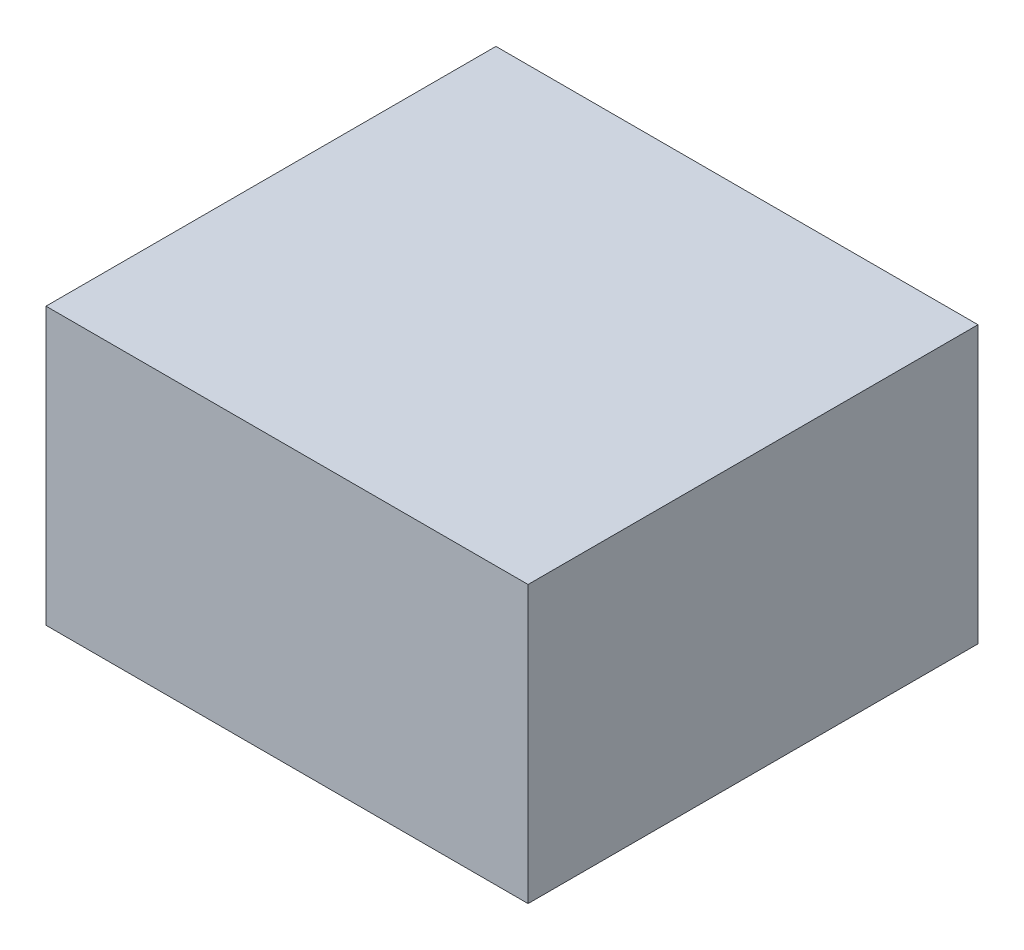
from build123d import *

# Parameters (mm, degrees)
BOSS_EXTRUDE1_DEPTH      = 43
BOSS_EXTRUDE1_DEPTH_BACK = 43
SKETCH1_W                = 150
SKETCH1_H                = 140
SKETCH1_W_2              = 148
SKETCH1_H_2              = 138
SKETCH3_W                = 150
SKETCH3_H                = 140
BOSS_EXTRUDE2_DEPTH      = 1
SKETCH4_W                = 150
SKETCH4_H                = 140
BOSS_EXTRUDE3_DEPTH      = 1
SKETCH2_R                = 1.5
SKETCH2_R_2              = 2.5
SKETCH2_R_3              = 2
SKETCH2_R_4              = 1
CUT_EXTRUDE1_DEPTH       = 1


with BuildPart() as part:
    # Sketch1 → Boss-Extrude1 (new, two sides: drawn at the far end of the back side and taken through both)
    with BuildSketch(Plane(origin=(0, 0, 0), x_dir=(1, 0, 0), z_dir=(0, 1, 0)).offset(-BOSS_EXTRUDE1_DEPTH_BACK)):
        Rectangle(SKETCH1_W, SKETCH1_H)
        Rectangle(SKETCH1_W_2, SKETCH1_H_2, mode=Mode.SUBTRACT)
    extrude(amount=BOSS_EXTRUDE1_DEPTH + BOSS_EXTRUDE1_DEPTH_BACK)

    # Sketch3 → Boss-Extrude2 (add)
    with BuildSketch(Plane(origin=(0, 43, 0), x_dir=(1, 0, 0), z_dir=(0, 1, 0))):
        Rectangle(SKETCH3_W, SKETCH3_H)
    extrude(amount=-BOSS_EXTRUDE2_DEPTH)

    # Sketch4 → Boss-Extrude3 (add)
    with BuildSketch(Plane.XZ.offset(43)):
        Rectangle(SKETCH4_W, SKETCH4_H)
    extrude(amount=-BOSS_EXTRUDE3_DEPTH)

    # Sketch2 → Cut-Extrude1 (cut)
    with BuildSketch(Plane(origin=(0, 0, -70), x_dir=(-1, 0, 0), z_dir=(0, 0, -1))):
        with Locations((-69, 37.5)):
            Circle(SKETCH2_R)
        with Locations((-69, -26.5)):
            Circle(SKETCH2_R)
        with Locations((69, 37.5)):
            Circle(SKETCH2_R)
        with Locations((45, -37.5)):
            Circle(SKETCH2_R)
        with Locations((-59, 36)):
            Circle(SKETCH2_R_2)
        with Locations((13, 36)):
            Circle(SKETCH2_R_2)
        with Locations((13, -36)):
            Circle(SKETCH2_R_2)
        with Locations((-59, -36)):
            Circle(SKETCH2_R_2)
        with Locations((28, -1.5)):
            Circle(SKETCH2_R_3)
        with Locations((62, -1.5)):
            Circle(SKETCH2_R_3)
        with Locations((25, -19)):
            Circle(SKETCH2_R_4)
        with Locations((65, -19)):
            Circle(SKETCH2_R_4)
        with BuildLine():
            Line((-44.094074997, 38.5), (-35.56980509, 38.5))
            ThreePointArc((-35.56980509, 38.5), (-51.637824638, 28.637824638), (-61.5, 12.56980509))
            Line((-61.5, 12.56980509), (-61.5, 21.094074997))
            ThreePointArc((-61.5, 21.094074997), (-54.041987694, 31.041987694), (-44.094074997, 38.5))
        make_face()
        with BuildLine():
            Line((-1.905925003, 38.5), (-10.43019491, 38.5))
            ThreePointArc((-10.43019491, 38.5), (5.637824638, 28.637824638), (15.5, 12.56980509))
            Line((15.5, 12.56980509), (15.5, 21.094074997))
            ThreePointArc((15.5, 21.094074997), (8.041987694, 31.041987694), (-1.905925003, 38.5))
        make_face()
        with BuildLine():
            Line((15.5, -21.094074997), (15.5, -12.56980509))
            ThreePointArc((15.5, -12.56980509), (5.637824638, -28.637824638), (-10.43019491, -38.5))
            Line((-10.43019491, -38.5), (-1.905925003, -38.5))
            ThreePointArc((-1.905925003, -38.5), (8.041987694, -31.041987694), (15.5, -21.094074997))
        make_face()
        with BuildLine():
            Line((-44.094074997, -38.5), (-35.56980509, -38.5))
            ThreePointArc((-35.56980509, -38.5), (-51.637824638, -28.637824638), (-61.5, -12.56980509))
            Line((-61.5, -12.56980509), (-61.5, -21.094074997))
            ThreePointArc((-61.5, -21.094074997), (-54.041987694, -31.041987694), (-44.094074997, -38.5))
        make_face()
        Polygon((44.25, -0.75), (45.75, -0.75), (46.760362971, 1), (49.647114317, 1), (51.09048999, -1.5), (49.647114317, -4), (46.760362971, -4), (45.75, -2.25), (44.25, -2.25), (43.239637029, -4), (40.352885683, -4), (38.90951001, -1.5), (40.352885683, 1), (43.239637029, 1), align=None)
        with BuildLine():
            Line((33.5, -28.5), (56.5, -28.5))
            ThreePointArc((56.5, -28.5), (57.914213562, -27.914213562), (58.5, -26.5))
            Line((58.5, -26.5), (58.5, -11.5))
            ThreePointArc((58.5, -11.5), (57.914213562, -10.085786438), (56.5, -9.5))
            Line((56.5, -9.5), (33.5, -9.5))
            ThreePointArc((33.5, -9.5), (32.085786438, -10.085786438), (31.5, -11.5))
            Line((31.5, -11.5), (31.5, -26.5))
            ThreePointArc((31.5, -26.5), (32.085786438, -27.914213562), (33.5, -28.5))
        make_face()
        with BuildLine():
            ThreePointArc((-37.984035323, 14.713214654), (-37.945346656, 10.470750371), (-33.702882373, 10.509439038))
            ThreePointArc((-33.702882373, 10.509439038), (-30.5, 12.990381057), (-26.75, 14.523687548))
            ThreePointArc((-26.75, 14.523687548), (-24.59526249, 18.178425058), (-28.25, 20.333162568))
            ThreePointArc((-28.25, 20.333162568), (-33.5, 18.186533479), (-37.984035323, 14.713214654))
        make_face()
        with BuildLine():
            ThreePointArc((-45.671992068, 18.874076817), (-45.285763398, 14.649052862), (-41.060739444, 15.035281532))
            ThreePointArc((-41.060739444, 15.035281532), (-34.75, 20.351596989), (-26.990566038, 23.158699935))
            ThreePointArc((-26.990566038, 23.158699935), (-24.543570221, 26.624563677), (-28.009433962, 29.071559493))
            ThreePointArc((-28.009433962, 29.071559493), (-37.75, 25.547749412), (-45.671992068, 18.874076817))
        make_face()
        with BuildLine():
            ThreePointArc((-53.192972047, 23.073457455), (-52.630905106, 18.868213021), (-48.425660672, 19.430279962))
            ThreePointArc((-48.425660672, 19.430279962), (-39, 27.712812921), (-27.114285714, 31.734408031))
            ThreePointArc((-27.114285714, 31.734408031), (-24.524899247, 35.095223069), (-27.885714286, 37.684609536))
            ThreePointArc((-27.885714286, 37.684609536), (-42, 32.908965344), (-53.192972047, 23.073457455))
        make_face()
        with BuildLine():
            ThreePointArc((-12.297117627, 10.509439038), (-15.5, 12.990381057), (-19.25, 14.523687548))
            ThreePointArc((-19.25, 14.523687548), (-21.40473751, 18.178425058), (-17.75, 20.333162568))
            ThreePointArc((-17.75, 20.333162568), (-12.5, 18.186533479), (-8.015964677, 14.713214654))
            ThreePointArc((-8.015964677, 14.713214654), (-8.054653344, 10.470750371), (-12.297117627, 10.509439038))
        make_face()
        with BuildLine():
            ThreePointArc((-17.990566038, 29.071559493), (-21.456429779, 26.624563677), (-19.009433962, 23.158699935))
            ThreePointArc((-19.009433962, 23.158699935), (-11.25, 20.351596989), (-4.939260556, 15.035281532))
            ThreePointArc((-4.939260556, 15.035281532), (-0.714236602, 14.649052862), (-0.328007932, 18.874076817))
            ThreePointArc((-0.328007932, 18.874076817), (-8.25, 25.547749412), (-17.990566038, 29.071559493))
        make_face()
        with BuildLine():
            ThreePointArc((7.192972047, 23.073457455), (6.630905106, 18.868213021), (2.425660672, 19.430279962))
            ThreePointArc((2.425660672, 19.430279962), (-7, 27.712812921), (-18.885714286, 31.734408031))
            ThreePointArc((-18.885714286, 31.734408031), (-21.475100753, 35.095223069), (-18.114285714, 37.684609536))
            ThreePointArc((-18.114285714, 37.684609536), (-4, 32.908965344), (7.192972047, 23.073457455))
        make_face()
        with BuildLine():
            ThreePointArc((-8.547117627, -4.01424851), (-8, 0), (-8.547117627, 4.01424851))
            ThreePointArc((-8.547117627, 4.01424851), (-6.459390854, 7.707674687), (-2.765964677, 5.619947914))
            ThreePointArc((-2.765964677, 5.619947914), (-2, 0), (-2.765964677, -5.619947914))
            ThreePointArc((-2.765964677, -5.619947914), (-6.459390854, -7.707674687), (-8.547117627, -4.01424851))
        make_face()
        with BuildLine():
            ThreePointArc((4.68142603, 10.197482677), (0.829333619, 11.975510814), (-0.948694518, 8.123418404))
            ThreePointArc((-0.948694518, 8.123418404), (0.5, 0), (-0.948694518, -8.123418404))
            ThreePointArc((-0.948694518, -8.123418404), (0.829333619, -11.975510814), (4.68142603, -10.197482677))
            ThreePointArc((4.68142603, -10.197482677), (6.5, 0), (4.68142603, 10.197482677))
        make_face()
        with BuildLine():
            ThreePointArc((12.078686333, -14.611152081), (8.155804353, -16.227010048), (6.539946386, -12.304128068))
            ThreePointArc((6.539946386, -12.304128068), (9, 0), (6.539946386, 12.304128068))
            ThreePointArc((6.539946386, 12.304128068), (8.155804353, 16.227010048), (12.078686333, 14.611152081))
            ThreePointArc((12.078686333, 14.611152081), (15, 0), (12.078686333, -14.611152081))
        make_face()
        with BuildLine():
            ThreePointArc((-19.25, -14.523687548), (-15.5, -12.990381057), (-12.297117627, -10.509439038))
            ThreePointArc((-12.297117627, -10.509439038), (-8.054653344, -10.470750371), (-8.015964677, -14.713214654))
            ThreePointArc((-8.015964677, -14.713214654), (-12.5, -18.186533479), (-17.75, -20.333162568))
            ThreePointArc((-17.75, -20.333162568), (-21.40473751, -18.178425058), (-19.25, -14.523687548))
        make_face()
        with BuildLine():
            ThreePointArc((-0.328007932, -18.874076817), (-0.714236602, -14.649052862), (-4.939260556, -15.035281532))
            ThreePointArc((-4.939260556, -15.035281532), (-11.25, -20.351596989), (-19.009433962, -23.158699935))
            ThreePointArc((-19.009433962, -23.158699935), (-21.456429779, -26.624563677), (-17.990566038, -29.071559493))
            ThreePointArc((-17.990566038, -29.071559493), (-8.25, -25.547749412), (-0.328007932, -18.874076817))
        make_face()
        with BuildLine():
            ThreePointArc((-18.114285714, -37.684609536), (-21.475100753, -35.095223069), (-18.885714286, -31.734408031))
            ThreePointArc((-18.885714286, -31.734408031), (-7, -27.712812921), (2.425660672, -19.430279962))
            ThreePointArc((2.425660672, -19.430279962), (6.630905106, -18.868213021), (7.192972047, -23.073457455))
            ThreePointArc((7.192972047, -23.073457455), (-4, -32.908965344), (-18.114285714, -37.684609536))
        make_face()
        with BuildLine():
            ThreePointArc((-33.702882373, -10.509439038), (-30.5, -12.990381057), (-26.75, -14.523687548))
            ThreePointArc((-26.75, -14.523687548), (-24.59526249, -18.178425058), (-28.25, -20.333162568))
            ThreePointArc((-28.25, -20.333162568), (-33.5, -18.186533479), (-37.984035323, -14.713214654))
            ThreePointArc((-37.984035323, -14.713214654), (-37.945346656, -10.470750371), (-33.702882373, -10.509439038))
        make_face()
        with BuildLine():
            ThreePointArc((-28.009433962, -29.071559493), (-24.543570221, -26.624563677), (-26.990566038, -23.158699935))
            ThreePointArc((-26.990566038, -23.158699935), (-34.75, -20.351596989), (-41.060739444, -15.035281532))
            ThreePointArc((-41.060739444, -15.035281532), (-45.285763398, -14.649052862), (-45.671992068, -18.874076817))
            ThreePointArc((-45.671992068, -18.874076817), (-37.75, -25.547749412), (-28.009433962, -29.071559493))
        make_face()
        with BuildLine():
            ThreePointArc((-53.192972047, -23.073457455), (-52.630905106, -18.868213021), (-48.425660672, -19.430279962))
            ThreePointArc((-48.425660672, -19.430279962), (-39, -27.712812921), (-27.114285714, -31.734408031))
            ThreePointArc((-27.114285714, -31.734408031), (-24.524899247, -35.095223069), (-27.885714286, -37.684609536))
            ThreePointArc((-27.885714286, -37.684609536), (-42, -32.908965344), (-53.192972047, -23.073457455))
        make_face()
        with BuildLine():
            ThreePointArc((-37.452882373, 4.01424851), (-38, 0), (-37.452882373, -4.01424851))
            ThreePointArc((-37.452882373, -4.01424851), (-39.540609146, -7.707674687), (-43.234035323, -5.619947914))
            ThreePointArc((-43.234035323, -5.619947914), (-44, 0), (-43.234035323, 5.619947914))
            ThreePointArc((-43.234035323, 5.619947914), (-39.540609146, 7.707674687), (-37.452882373, 4.01424851))
        make_face()
        with BuildLine():
            ThreePointArc((-50.68142603, -10.197482677), (-46.829333619, -11.975510814), (-45.051305482, -8.123418404))
            ThreePointArc((-45.051305482, -8.123418404), (-46.5, 0), (-45.051305482, 8.123418404))
            ThreePointArc((-45.051305482, 8.123418404), (-46.829333619, 11.975510814), (-50.68142603, 10.197482677))
            ThreePointArc((-50.68142603, 10.197482677), (-52.5, 0), (-50.68142603, -10.197482677))
        make_face()
        with BuildLine():
            ThreePointArc((-58.078686333, 14.611152081), (-54.155804353, 16.227010048), (-52.539946386, 12.304128068))
            ThreePointArc((-52.539946386, 12.304128068), (-55, 0), (-52.539946386, -12.304128068))
            ThreePointArc((-52.539946386, -12.304128068), (-54.155804353, -16.227010048), (-58.078686333, -14.611152081))
            ThreePointArc((-58.078686333, -14.611152081), (-61, 0), (-58.078686333, 14.611152081))
        make_face()
    extrude(amount=-CUT_EXTRUDE1_DEPTH, mode=Mode.SUBTRACT)


solid = part.part
